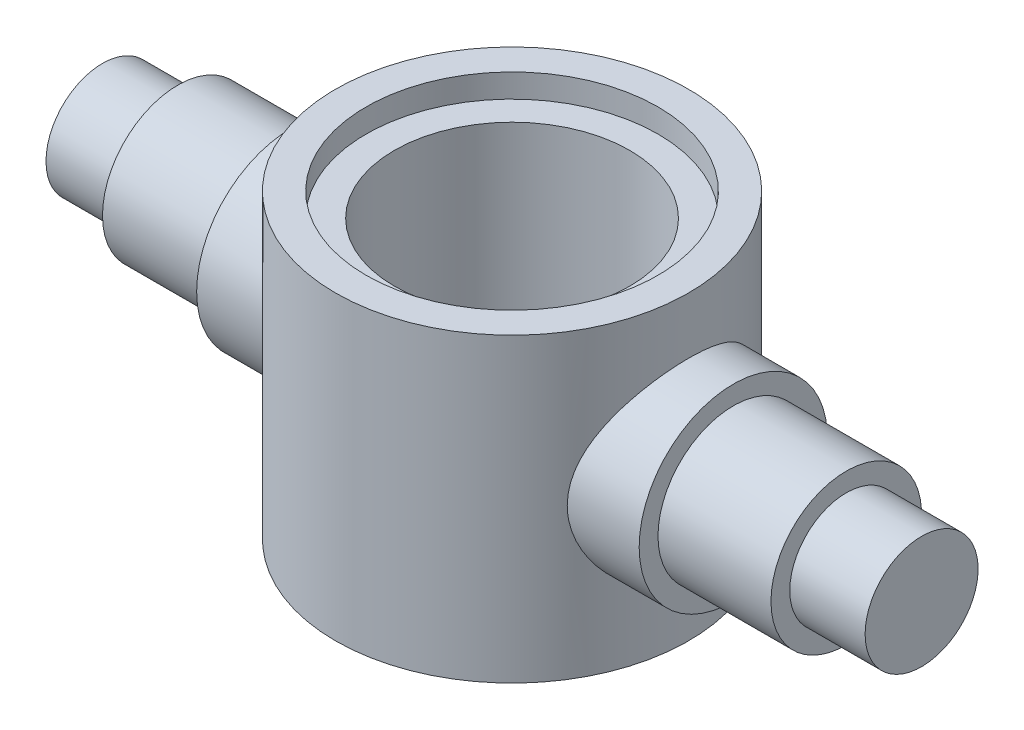
from build123d import *

# Parameters (mm, degrees)
SKETCH2_R           = 37.5
BOSS_EXTRUDE1_DEPTH = 32
HOLE1_D             = 50
HOLE1_CBORE_D       = 62
HOLE1_CBORE_DEPTH   = 5


with BuildPart() as part:
    # Sketch1 → Revolve1 (revolve)
    with BuildSketch(Plane(origin=(0, 0, 0), x_dir=(1, 0, 0), z_dir=(0, 1, 0)), mode=Mode.PRIVATE) as revolve1_sk:
        Polygon((-87, 0), (-87, 12), (-71, 12), (-71, 16), (-47, 16), (-47, 20), (47, 20), (47, 16), (71, 16), (71, 12), (87, 12), (87, 0), align=None)
    revolve(revolve1_sk.sketch.rotate(Axis((-87, 0, 0), (1, 0, 0)), 180), axis=Axis((-87, 0, 0), (1, 0, 0)))

    # Sketch2 → Boss-Extrude1 (add, symmetric)
    with BuildSketch(Plane(origin=(0, 0, 0), x_dir=(1, 0, 0), z_dir=(0, 1, 0))):
        with Locations(Location((0, 0, 0), (0, 0, 270))):
            Circle(SKETCH2_R)
    extrude(amount=BOSS_EXTRUDE1_DEPTH, both=True)

    # Hole1 (through all)
    with Locations(Plane(origin=(0, 32, 0), x_dir=(1, 0, 0), z_dir=(0, 1, 0))):
        with Locations((0, 0)):
            CounterBoreHole(HOLE1_D / 2, HOLE1_CBORE_D / 2, HOLE1_CBORE_DEPTH)


solid = part.part
